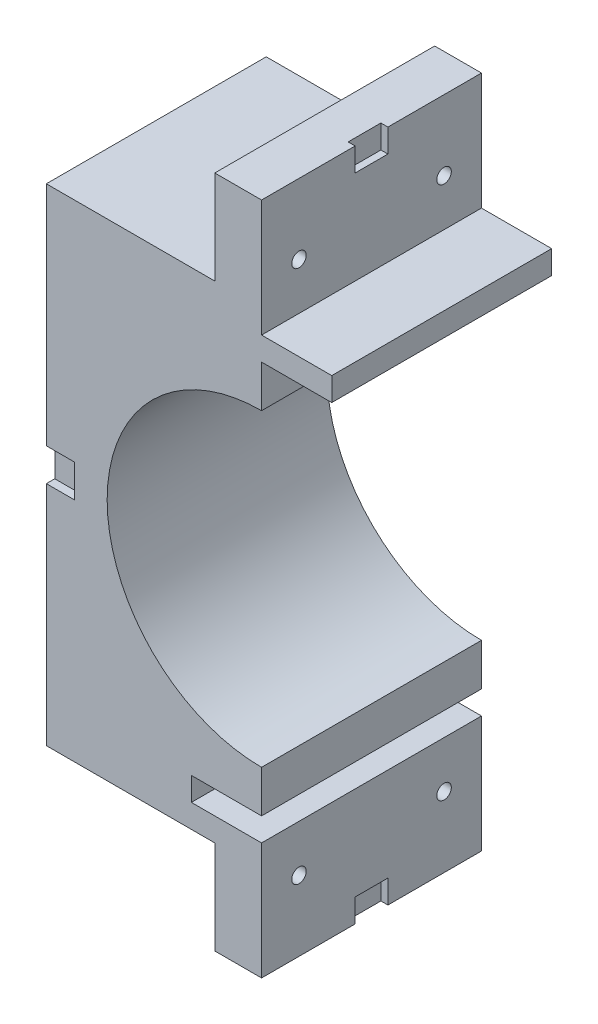
from build123d import *

# Parameters (mm, degrees)
EXTRUDE_1_DEPTH     = 47
SKETCH_2_W          = 47
SKETCH_2_H          = 20
EXTRUDE_2_DEPTH     = 10
SKETCH_5_W          = 47
SKETCH_5_H          = 20
EXTRUDE_5_DEPTH     = 10
SKETCH_6_W          = 15
SKETCH_6_H          = 5
CUT_EXTRUDE_1_DEPTH = 98.514101544
SKETCH_7_W          = 15
SKETCH_7_H          = 5
EXTRUDE_6_DEPTH     = 47
SKETCH_8_W          = 1.5
SKETCH_8_H          = 7
CUT_EXTRUDE_2_DEPTH = 5
SKETCH_10_R         = 1.55
CUT_EXTRUDE_4_DEPTH = 98.514101544
SKETCH_12_R         = 1.55
CUT_EXTRUDE_5_DEPTH = 94.214805691
SKETCH_13_W         = 1.5
SKETCH_13_H         = 7
CUT_EXTRUDE_6_DEPTH = 5
SKETCH_14_W         = 1.8
SKETCH_14_H         = 7
CUT_EXTRUDE_7_DEPTH = 6


with BuildPart() as part:
    # 草图1 → 凸台-拉伸1 (new body)
    with BuildSketch(Plane.XY):
        with BuildLine():
            Line((0, 33), (0, 52))
            Line((0, 52), (-46, 52))
            Line((-46, 52), (-46, -52))
            Line((-46, -52), (0, -52))
            Line((0, -52), (0, -33))
            ThreePointArc((0, -33), (-33, 0), (0, 33))
        make_face()
    extrude(amount=EXTRUDE_1_DEPTH)

    # 草图2 → 凸台-拉伸2 (add)
    with BuildSketch(Plane(origin=(-10, 0, 0), x_dir=(0, 0, -1), z_dir=(1, 0, 0))):
        with Locations((-23.5, 62)):
            Rectangle(SKETCH_2_W, SKETCH_2_H)
    extrude(amount=EXTRUDE_2_DEPTH)

    # 草图5 → 凸台-拉伸5 (add)
    with BuildSketch(Plane(origin=(-10, 0, 0), x_dir=(0, 0, -1), z_dir=(1, 0, 0))):
        with Locations((-23.5, -62)):
            Rectangle(SKETCH_5_W, SKETCH_5_H)
    extrude(amount=EXTRUDE_5_DEPTH)

    # 草图6 → 切除-拉伸1 (cut, through all)
    with BuildSketch(Plane.XY.offset(47)):
        with Locations((-7.5, -44.5)):
            Rectangle(SKETCH_6_W, SKETCH_6_H)
    extrude(amount=-CUT_EXTRUDE_1_DEPTH, mode=Mode.SUBTRACT)

    # 草图7 → 凸台-拉伸6 (add, through all)
    with BuildSketch(Plane.XY.offset(47)):
        with Locations((7.5, 44.5)):
            Rectangle(SKETCH_7_W, SKETCH_7_H)
    extrude(amount=-EXTRUDE_6_DEPTH)

    # 草图8 → 切除-拉伸2 (cut)
    with BuildSketch(Plane.XZ.offset(72)):
        with Locations((-0.75, 23.5)):
            Rectangle(SKETCH_8_W, SKETCH_8_H)
    extrude(amount=-CUT_EXTRUDE_2_DEPTH, mode=Mode.SUBTRACT)

    # 草图10 → 切除-拉伸4 (cut, through all)
    with BuildSketch(Plane(origin=(0, 0, 0), x_dir=(0, 0, -1), z_dir=(1, 0, 0))):
        with Locations((-39, -57)):
            Circle(SKETCH_10_R)
        with Locations((-8, -57)):
            Circle(SKETCH_10_R)
    extrude(amount=-CUT_EXTRUDE_4_DEPTH, mode=Mode.SUBTRACT)

    # 草图12 → 切除-拉伸5 (cut, through all)
    with BuildSketch(Plane.ZY.offset(10)):
        with Locations((8, 57)):
            Circle(SKETCH_12_R)
        with Locations((39, 57)):
            Circle(SKETCH_12_R)
    extrude(amount=-CUT_EXTRUDE_5_DEPTH, mode=Mode.SUBTRACT)

    # 草图13 → 切除-拉伸6 (cut)
    with BuildSketch(Plane(origin=(0, 72, 0), x_dir=(1, 0, 0), z_dir=(0, 1, 0))):
        with Locations((-0.75, -23.5)):
            Rectangle(SKETCH_13_W, SKETCH_13_H)
    extrude(amount=-CUT_EXTRUDE_6_DEPTH, mode=Mode.SUBTRACT)

    # 草图14 → 切除-拉伸7 (cut)
    with BuildSketch(Plane.ZY.offset(46)):
        with Locations((46.1, 0)):
            Rectangle(SKETCH_14_W, SKETCH_14_H)
    extrude(amount=-CUT_EXTRUDE_7_DEPTH, mode=Mode.SUBTRACT)


solid = part.part
